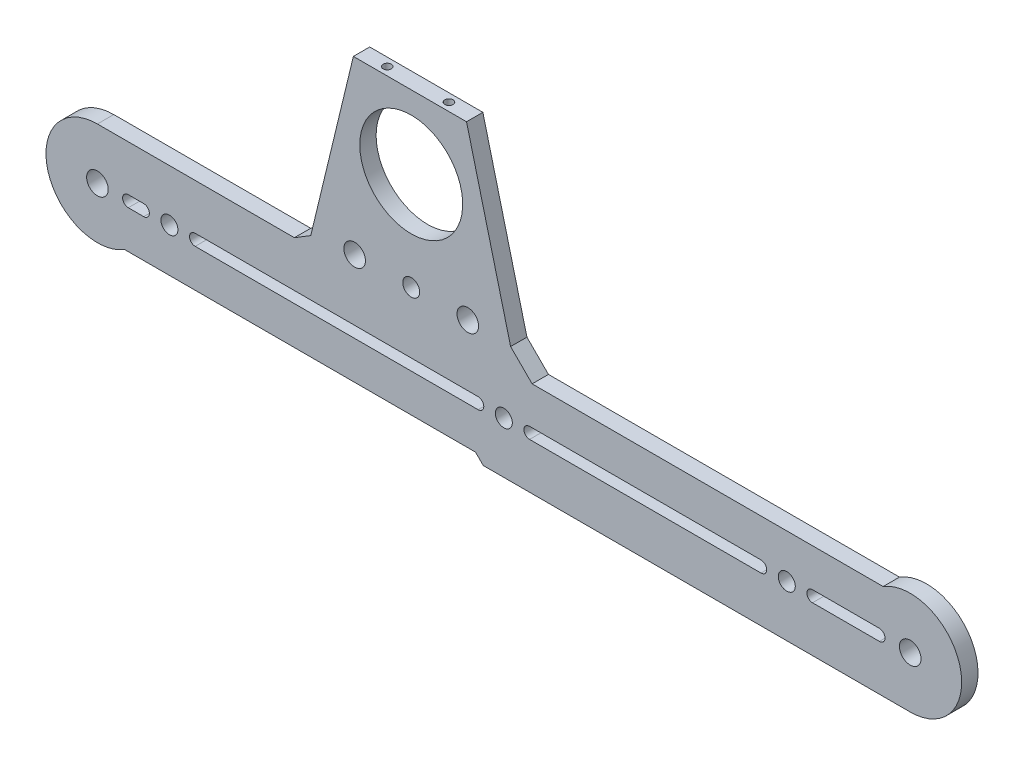
from build123d import *
from OCP.BRepFilletAPI import BRepFilletAPI_MakeChamfer

# Parameters (mm, degrees)
BOSS_EXTRUDE1_DEPTH             = 3.175
TAP_DRILL_FOR_M5X0_8_TAP1_D     = 4.2
BOSS_EXTRUDE2_DEPTH             = 3.175
TAP_DRILL_FOR_M5X0_8_TAP2_D     = 4.2
SKETCH11_R                      = 10
CUT_EXTRUDE3_DEPTH              = 3.175
TAP_DRILL_FOR_M4X0_7_TAP1_D     = 3.3
CUT_EXTRUDE5_DEPTH              = 3.175
CHAMFER1_SIZE                   = 2
CHAMFER1_SIZE2                  = 2.712078889
CHAMFER1_SIZE2_2                = 2.771226843
CUT_EXTRUDE6_START              = -9
CUT_EXTRUDE6_DEPTH              = 9
TAP_DRILL_FOR_M2X0_4_TAP1_D     = 1.6
TAP_DRILL_FOR_M2X0_4_TAP1_DEPTH = 3
TAP_DRILL_FOR_M2X0_4_TAP1_TIP   = 0.480688495


with BuildPart() as part:
    # Sketch1 → Boss-Extrude1 (new body)
    with BuildSketch(Plane.XY):
        with BuildLine():
            Line((-79, 10), (79, 10))
            ThreePointArc((79, 10), (89, 0), (79, -10))
            Line((79, -10), (-79, -10))
            ThreePointArc((-79, -10), (-89, 0), (-79, 10))
        make_face()
    extrude(amount=BOSS_EXTRUDE1_DEPTH)

    # Tap Drill for M5x0.8 Tap1 (through all)
    with Locations(Plane(origin=(0, 0, 0), x_dir=(-1, 0, 0), z_dir=(0, 0, -1))):
        with Locations((-79, 0), (79, 0)):
            Hole(TAP_DRILL_FOR_M5X0_8_TAP1_D / 2)

    # Sketch8 → Boss-Extrude2 (add)
    with BuildSketch(Plane(origin=(0, 0, 0), x_dir=(-1, 0, 0), z_dir=(0, 0, -1))):
        Polygon((29.25, 46.25), (7.25, 46.25), (-2, 10), (38, 10), align=None)
    extrude(amount=-BOSS_EXTRUDE2_DEPTH)

    # Tap Drill for M5x0.8 Tap2 (through all)
    with Locations(Plane(origin=(0, 0, 0), x_dir=(-1, 0, 0), z_dir=(0, 0, -1))):
        with Locations((7, 13), (29, 13)):
            Hole(TAP_DRILL_FOR_M5X0_8_TAP2_D / 2)

    # Sketch11 → Cut-Extrude3 (cut)
    with BuildSketch(Plane(origin=(0, 0, 0), x_dir=(-1, 0, 0), z_dir=(0, 0, -1))):
        with Locations((18, 32)):
            Circle(SKETCH11_R)
    extrude(amount=-CUT_EXTRUDE3_DEPTH, mode=Mode.SUBTRACT)

    # Tap Drill for M4x0.7 Tap1 (through all)
    with Locations(Plane(origin=(0, 0, 0), x_dir=(-1, 0, 0), z_dir=(0, 0, -1))):
        with Locations((0, 0), (-55, 0), (18, 13), (65, 0)):
            Hole(TAP_DRILL_FOR_M4X0_7_TAP1_D / 2)

    # Sketch17 → Cut-Extrude5 (cut)
    with BuildSketch(Plane(origin=(0, 0, 0), x_dir=(-1, 0, 0), z_dir=(0, 0, -1))):
        with BuildLine():
            Line((-73, 1.1), (-60, 1.1))
            ThreePointArc((-60, 1.1), (-58.9, 0), (-60, -1.1))
            Line((-60, -1.1), (-73, -1.1))
            ThreePointArc((-73, -1.1), (-74.1, 0), (-73, 1.1))
        make_face()
        with BuildLine():
            Line((-50, 1.1), (-5, 1.1))
            ThreePointArc((-5, 1.1), (-3.9, 0), (-5, -1.1))
            Line((-5, -1.1), (-50, -1.1))
            ThreePointArc((-50, -1.1), (-51.1, 0), (-50, 1.1))
        make_face()
        with BuildLine():
            Line((5, 1.1), (60, 1.1))
            ThreePointArc((60, 1.1), (61.1, 0), (60, -1.1))
            Line((60, -1.1), (5, -1.1))
            ThreePointArc((5, -1.1), (3.9, 0), (5, 1.1))
        make_face()
        with BuildLine():
            Line((70, 1.1), (73, 1.1))
            ThreePointArc((73, 1.1), (74.1, 0), (73, -1.1))
            Line((73, -1.1), (70, -1.1))
            ThreePointArc((70, -1.1), (68.9, 0), (70, 1.1))
        make_face()
    extrude(amount=-CUT_EXTRUDE5_DEPTH, mode=Mode.SUBTRACT)

    # Chamfer1: one chamfer whose edges measure the first distance from different faces: ONE call of the kernel's chamfer builder (chamfer() names one face for all edges)
    chamfer1_edges_1 = [part.edges().sort_by_distance(p)[0] for p in [
        (-38, 10, 1.5875),
    ]]
    chamfer1_side_1 = [part.faces().sort_by_distance(p)[0] for p in [
        (-33.625, 28.125, 1.5875),
    ]]
    chamfer1_edges_2 = [part.edges().sort_by_distance(p)[0] for p in [
        (2, 10, 1.5875),
    ]]
    chamfer1_side_2 = [part.faces().sort_by_distance(p)[0] for p in [
        (40.5, 10, 1.5875),
    ]]
    chamfer1 = BRepFilletAPI_MakeChamfer(part.part.solid().wrapped)
    for e in chamfer1_edges_1:
        chamfer1.Add(CHAMFER1_SIZE, CHAMFER1_SIZE2, e.wrapped, chamfer1_side_1[0].wrapped)  # the first distance lies on this face
    for e in chamfer1_edges_2:
        chamfer1.Add(CHAMFER1_SIZE, CHAMFER1_SIZE2_2, e.wrapped, chamfer1_side_2[0].wrapped)  # the first distance lies on this face
    add(Compound.cast(chamfer1.Shape()), mode=Mode.REPLACE)

    # Sketch18 → Cut-Extrude6 (cut)
    with BuildSketch(Plane.XY.offset(3.175).offset(CUT_EXTRUDE6_START)):
        with BuildLine():
            Line((4, 10), (5.5, 8.5))
            Line((5.5, 8.5), (73.732173124, 8.5))
            ThreePointArc((73.732173124, 8.5), (76.261387212, 9.617692031), (79, 10))
            Line((79, 10), (4, 10))
        make_face()
        with BuildLine():
            Line((-4, -10), (-79, -10))
            ThreePointArc((-79, -10), (-76.261387212, -9.617692031), (-73.732173124, -8.5))
            Line((-73.732173124, -8.5), (-5.5, -8.5))
            Line((-5.5, -8.5), (-4, -10))
        make_face()
    extrude(amount=CUT_EXTRUDE6_DEPTH, mode=Mode.SUBTRACT)

    # Tap Drill for M2x0.4 Tap1
    with Locations(Plane(origin=(0, 46.25, 0), x_dir=(1, 0, 0), z_dir=(0, 1, 0))):
        with Locations((-24.25, -1.5875), (-12.25, -1.5875)):
            Hole(TAP_DRILL_FOR_M2X0_4_TAP1_D / 2, depth=TAP_DRILL_FOR_M2X0_4_TAP1_DEPTH)
            with Locations((0, 0, -(TAP_DRILL_FOR_M2X0_4_TAP1_DEPTH + TAP_DRILL_FOR_M2X0_4_TAP1_TIP / 2))):  # 118° drill point
                Cone(0, TAP_DRILL_FOR_M2X0_4_TAP1_D / 2, TAP_DRILL_FOR_M2X0_4_TAP1_TIP, mode=Mode.SUBTRACT)


solid = part.part
